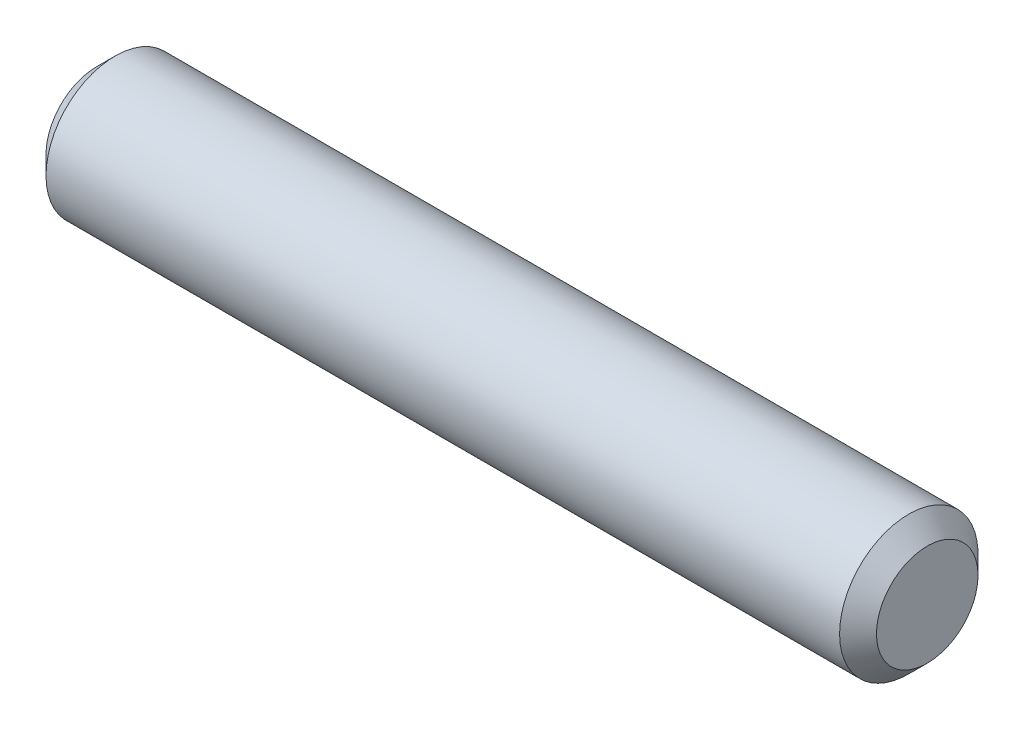
from build123d import *


with BuildPart() as part:
    # Sketch1 → Revolve1 (revolve)
    with BuildSketch(Plane.XY, mode=Mode.PRIVATE) as revolve1_sk:
        Polygon((-7.193771626, -1.946366782), (1.806228374, -1.946366782), (1.806228374, -2.496366782), (1.606228374, -2.696366782), (-6.993771626, -2.696366782), (-7.193771626, -2.496366782), align=None)
    revolve(revolve1_sk.sketch.rotate(Axis((-7.193771626, -1.946366782, 0), (1, 0, 0)), 270), axis=Axis((-7.193771626, -1.946366782, 0), (1, 0, 0)))


solid = part.part
